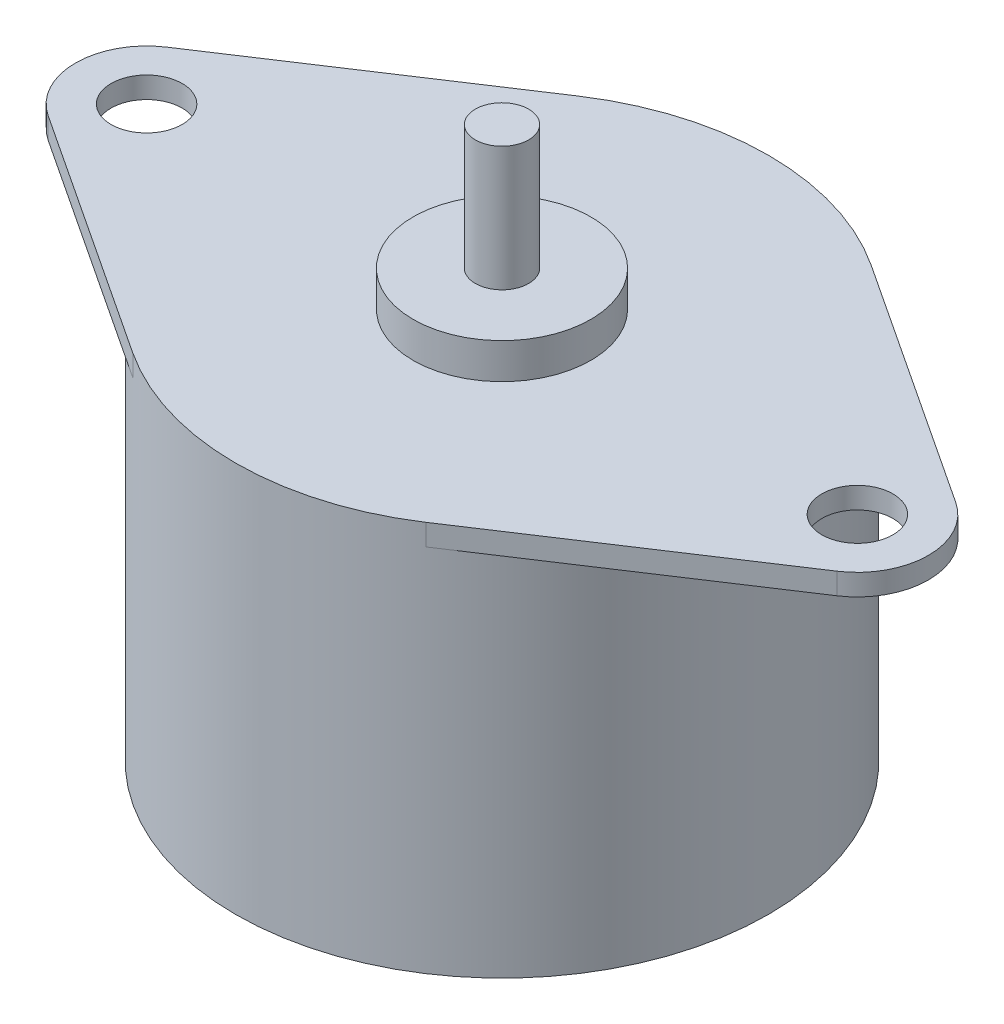
from build123d import *
from build123d.topology import SkipClean

# Parameters (mm, degrees)
SKETCH1_R           = 7.5
BOSS_EXTRUDE1_DEPTH = 10.4
SKETCH2_R           = 3
BOSS_EXTRUDE2_DEPTH = 1
SKETCH3_R           = 1
BOSS_EXTRUDE3_DEPTH = 0.6
SKETCH4_R           = 2.5
BOSS_EXTRUDE4_DEPTH = 1
SKETCH5_R           = 0.75
BOSS_EXTRUDE5_DEPTH = 3.5
BOSS_EXTRUDE6_START = 1
SKETCH6_R           = 0.75
BOSS_EXTRUDE6_DEPTH = 1


with BuildPart() as part:
    # Sketch1 → Boss-Extrude1 (new body)
    with BuildSketch(Plane(origin=(0, 0, 0), x_dir=(1, 0, 0), z_dir=(0, 1, 0))):
        with Locations(Location((0, 0, 0), (0, 0, 270))):
            Circle(SKETCH1_R)
    extrude(amount=BOSS_EXTRUDE1_DEPTH)

    # Sketch2 → Boss-Extrude2 (add)
    with BuildSketch(Plane.XZ):
        with Locations(Location((0, 0, 0), (0, 0, 90))):
            Circle(SKETCH2_R)
    extrude(amount=BOSS_EXTRUDE2_DEPTH)

    # Sketch3 → Boss-Extrude3 (add)
    with SkipClean():  # the faces are left unmerged after this step: merging them gives an invalid solid
        with BuildSketch(Plane(origin=(0, 10.4, 0), x_dir=(1, 0, 0), z_dir=(0, 1, 0))):
            with BuildLine():
                Line((-11.1, 1.670329309), (-4.125, 6.263734908))
                ThreePointArc((-4.125, 6.263734908), (0, 7.5), (4.125, 6.263734908))
                Line((4.125, 6.263734908), (11.1, 1.670329309))
                ThreePointArc((11.1, 1.670329309), (12, 0), (11.1, -1.670329309))
                Line((11.1, -1.670329309), (4.125, -6.263734908))
                ThreePointArc((4.125, -6.263734908), (0, -7.5), (-4.125, -6.263734908))
                Line((-4.125, -6.263734908), (-11.1, -1.670329309))
                ThreePointArc((-11.1, -1.670329309), (-12, 0), (-11.1, 1.670329309))
            make_face()
            with Locations(Location((-10, 0, 0), (0, 0, 270))):
                Circle(SKETCH3_R, mode=Mode.SUBTRACT)
            with Locations(Location((10, 0, 0), (0, 0, 270))):
                Circle(SKETCH3_R, mode=Mode.SUBTRACT)
        extrude(amount=BOSS_EXTRUDE3_DEPTH)

    # Sketch4 → Boss-Extrude4 (add)
    with SkipClean():  # the faces are left unmerged after this step: merging them gives an invalid solid
        with BuildSketch(Plane(origin=(0, 11, 0), x_dir=(1, 0, 0), z_dir=(0, 1, 0))):
            with Locations(Location((0, 0, 0), (0, 0, 270))):
                Circle(SKETCH4_R)
        extrude(amount=BOSS_EXTRUDE4_DEPTH)

    # Sketch5 → Boss-Extrude5 (add)
    with SkipClean():  # the faces are left unmerged after this step: merging them gives an invalid solid
        with BuildSketch(Plane(origin=(0, 12, 0), x_dir=(1, 0, 0), z_dir=(0, 1, 0))):
            with Locations(Location((0, 0, 0), (0, 0, 270))):
                Circle(SKETCH5_R)
        extrude(amount=BOSS_EXTRUDE5_DEPTH)

    # Sketch6 → Boss-Extrude6 (add)
    with SkipClean():  # the faces are left unmerged after this step: merging them gives an invalid solid
        with BuildSketch(Plane.XZ.offset(1).offset(BOSS_EXTRUDE6_START)):
            with Locations(Location((0, 0, 0), (0, 0, 90))):
                Circle(SKETCH6_R)
        extrude(amount=-BOSS_EXTRUDE6_DEPTH)


solid = part.part
